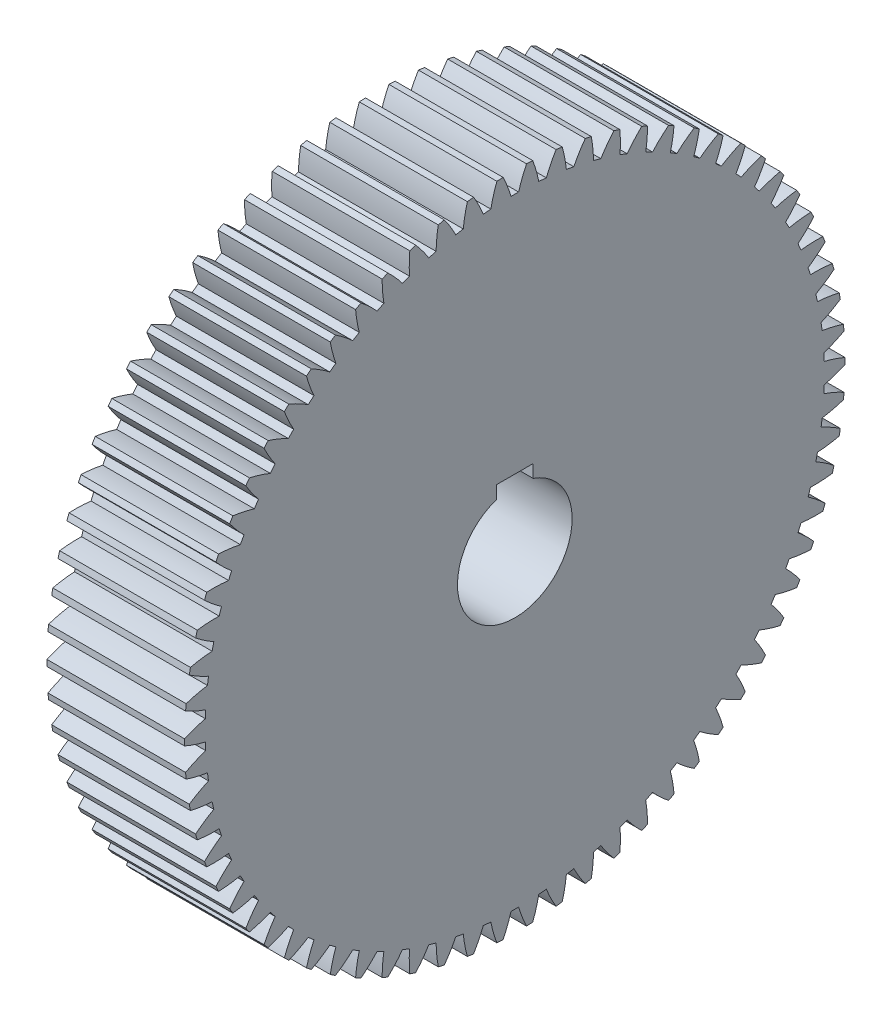
from build123d import *

# Parameters (mm, degrees)
BASPROSKE_W     = 60
BASPROSKE_H     = 144
TOOTHCUT_DEPTH  = 213.301672155
TEETHCUTS_COUNT = 70
TEETHCUTS_ANGLE = 354.857142857
BORSKE_R        = 25
BORE_DEPTH      = 60.0000508
KEYSKE_W        = 16
KEYSKE_H        = 29.3
KEYWAY_DEPTH    = 60.0000508


with BuildPart() as part:
    # BasProSke → Base-Revolve (revolve)
    with BuildSketch(Plane(origin=(0, 0, 0), x_dir=(1, 0, 0), z_dir=(0, 1, 0)), mode=Mode.PRIVATE) as base_revolve_sk:
        with Locations((30, 72)):
            Rectangle(BASPROSKE_W, BASPROSKE_H)
    revolve(base_revolve_sk.sketch.rotate(Axis((-10, 0, 0), (1, 0, 0)), 180), axis=Axis((-10, 0, 0), (1, 0, 0)))

    # TooCutSke → ToothCut (cut, through all)
    with BuildSketch(Plane(origin=(0, 0, 0), x_dir=(0, 0, -1), z_dir=(1, 0, 0))):
        with BuildLine():
            ThreePointArc((1.657468947, 134.988824714), (0, 134.999), (-1.657468947, 134.988824714))
            ThreePointArc((-1.657468947, 134.988824714), (-3.197517868, 139.535877203), (-5.121359626, 143.934316689))
            ThreePointArc((-5.121359626, 143.934316689), (0, 144.0254), (5.121359626, 143.934316689))
            ThreePointArc((5.121359626, 143.934316689), (3.197517868, 139.535877203), (1.657468947, 134.988824714))
        make_face()
    toothcut = extrude(amount=TOOTHCUT_DEPTH, mode=Mode.SUBTRACT)

    # TeethCuts: ToothCut ×70 about axis
    teethcuts_axis = Axis((-10, 0, 0), (1, 0, 0))
    for i in range(1, TEETHCUTS_COUNT):
        add(toothcut.rotate(teethcuts_axis, i * TEETHCUTS_ANGLE / (TEETHCUTS_COUNT - 1)), mode=Mode.SUBTRACT)

    # BorSke → Bore (cut, symmetric)
    with BuildSketch(Plane(origin=(0, 0, 0), x_dir=(0, 0, -1), z_dir=(1, 0, 0))):
        with Locations(Location((0, 0, 0), (0, 0, 180))):
            Circle(BORSKE_R)
    extrude(amount=BORE_DEPTH, both=True, mode=Mode.SUBTRACT)

    # KeySke → Keyway (cut, symmetric)
    with BuildSketch(Plane(origin=(0, 0, 0), x_dir=(0, 0, -1), z_dir=(1, 0, 0))):
        with Locations((0, 14.65)):
            Rectangle(KEYSKE_W, KEYSKE_H)
    extrude(amount=KEYWAY_DEPTH, both=True, mode=Mode.SUBTRACT)


solid = part.part
